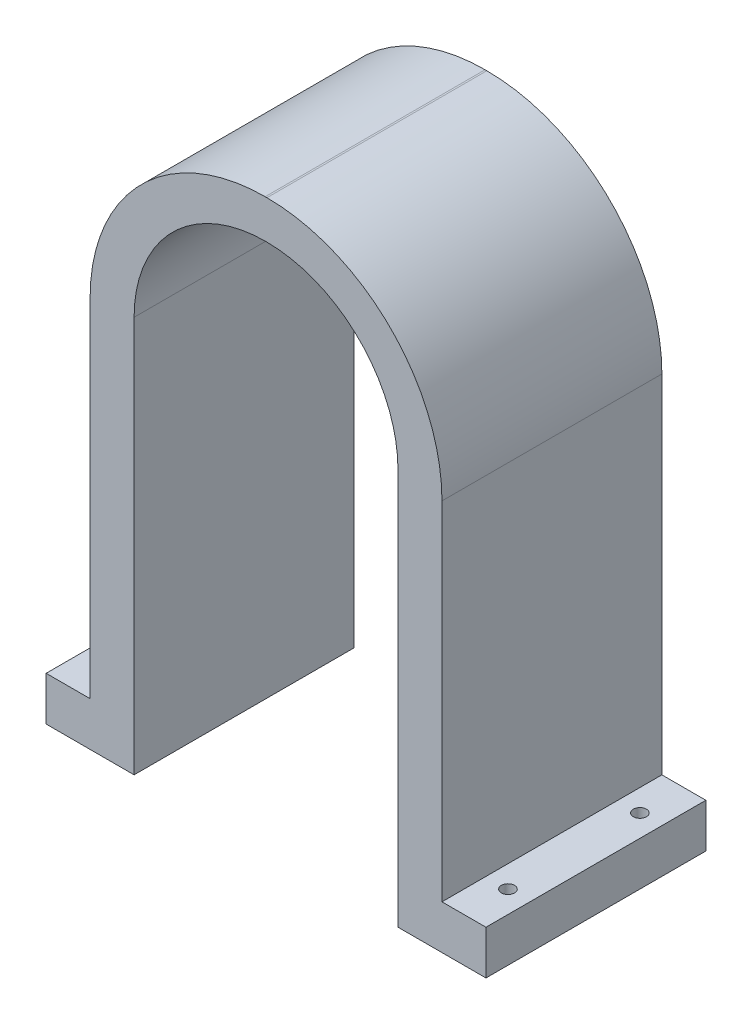
from build123d import *

# Parameters (mm, degrees)
BOSS_EXTRUDE2_DEPTH = 50
SKETCH3_R           = 1.5
CUT_EXTRUDE1_DEPTH  = 50


with BuildPart() as part:
    # Sketch1 → Boss-Extrude2 (new body)
    with BuildSketch(Plane.XY):
        with BuildLine():
            Line((-7.452830189, -1.235849057), (-7.452830189, -11.235849057))
            Line((-7.452830189, -11.235849057), (12.547169811, -11.235849057))
            Line((12.547169811, -11.235849057), (12.547169811, 78.864150943))
            ThreePointArc((12.547169811, 78.864150943), (21.304677054, 100.006643701), (42.447169811, 108.764150943))
            Line((42.447169811, 108.764150943), (42.647169811, 108.764150943))
            ThreePointArc((42.647169811, 108.764150943), (63.789662569, 100.006643701), (72.547169811, 78.864150943))
            Line((72.547169811, 78.864150943), (72.547169811, -11.235849057))
            Line((72.547169811, -11.235849057), (92.547169811, -11.235849057))
            Line((92.547169811, -11.235849057), (92.547169811, -1.235849057))
            Line((92.547169811, -1.235849057), (82.547169811, -1.235849057))
            Line((82.547169811, -1.235849057), (82.547169811, 77.704131501))
            ThreePointArc((82.547169811, 77.704131501), (70.890019703, 105.846981392), (42.747169811, 117.504131501))
            Line((42.747169811, 117.504131501), (42.347169811, 117.504131501))
            ThreePointArc((42.347169811, 117.504131501), (14.20431992, 105.846981392), (2.547169811, 77.704131501))
            Line((2.547169811, 77.704131501), (2.547169811, -1.235849057))
            Line((2.547169811, -1.235849057), (-7.452830189, -1.235849057))
        make_face()
    extrude(amount=BOSS_EXTRUDE2_DEPTH)

    # Sketch3 → Cut-Extrude1 (cut)
    with BuildSketch(Plane(origin=(0, -1.235849057, 0), x_dir=(1, 0, 0), z_dir=(0, 1, 0))):
        with Locations(Location((-2.452830189, -40, 0), (0, 0, 270))):
            Circle(SKETCH3_R)
        with Locations(Location((-2.452830189, -10, 0), (0, 0, 270))):
            Circle(SKETCH3_R)
        with Locations(Location((87.547169811, -10, 0), (0, 0, 270))):
            Circle(SKETCH3_R)
        with Locations(Location((87.547169811, -40, 0), (0, 0, 270))):
            Circle(SKETCH3_R)
    extrude(amount=-CUT_EXTRUDE1_DEPTH, mode=Mode.SUBTRACT)


solid = part.part
